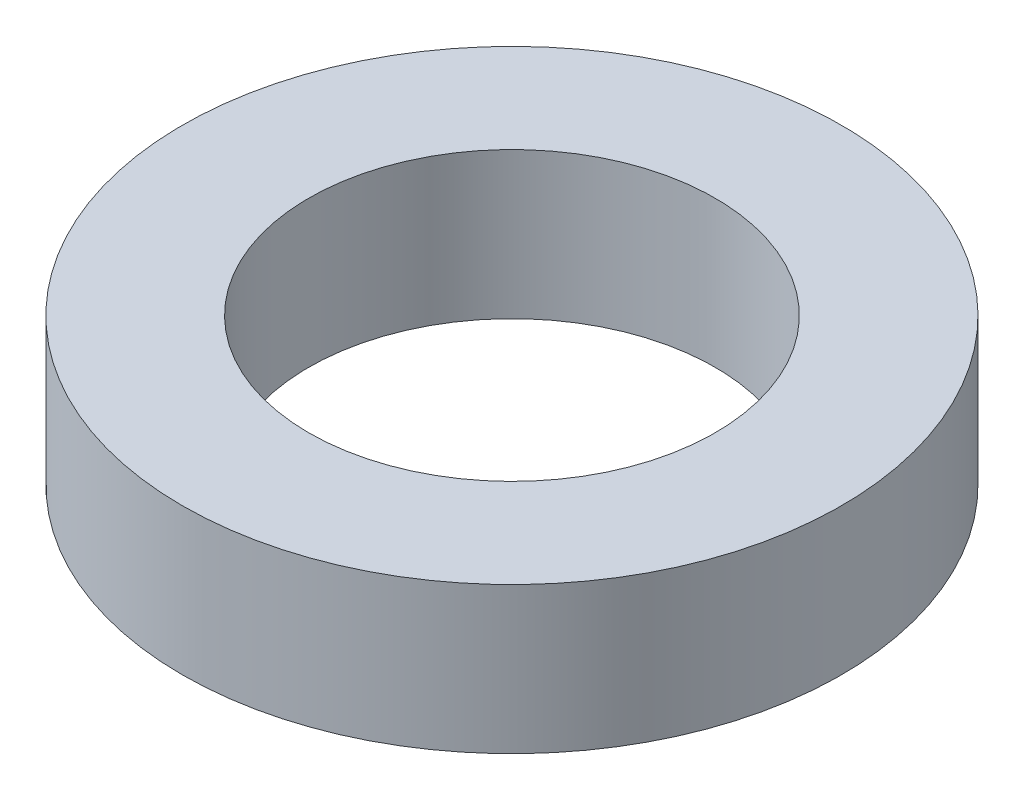
from build123d import *

# Parameters (mm, degrees)
SKETCH1_R           = 22.5
SKETCH1_R_2         = 13.875
BOSS_EXTRUDE1_DEPTH = 10


with BuildPart() as part:
    # Sketch1 → Boss-Extrude1 (new body)
    with BuildSketch(Plane(origin=(0, 0, 0), x_dir=(1, 0, 0), z_dir=(0, 1, 0))):
        with Locations(Location((0, 0, 0), (0, 0, 270))):
            Circle(SKETCH1_R)
        with Locations(Location((0, 0, 0), (0, 0, 270))):
            Circle(SKETCH1_R_2, mode=Mode.SUBTRACT)
    extrude(amount=BOSS_EXTRUDE1_DEPTH)


solid = part.part
